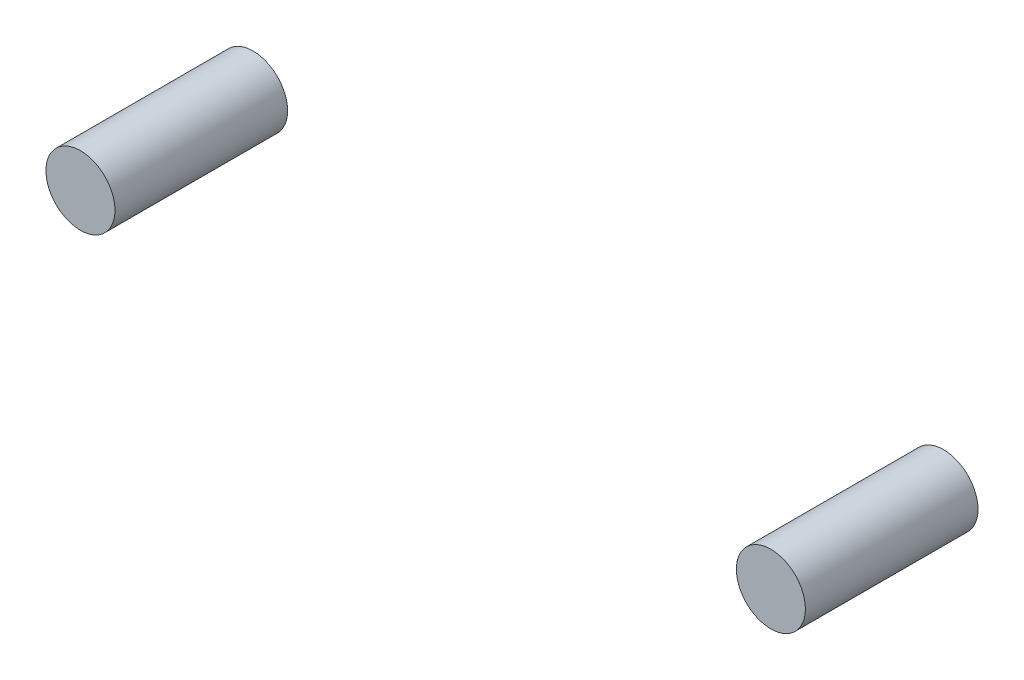
from build123d import *

# Parameters (mm, degrees)
SKETCH_1_R        = 1
EXTRUDE_1_DEPTH   = 5
EXTRUDE_1_2_DEPTH = 5


with BuildPart() as part:
    # 草图1 → 凸台-拉伸1 (new body)
    with BuildSketch(Plane.XY):
        with Locations((-8.861646235, 0)):
            Circle(SKETCH_1_R)
    extrude(amount=EXTRUDE_1_DEPTH)


with BuildPart() as body_2:
    # 草图1 → Extrude 1 2 (new body)
    with BuildSketch(Plane.XY):
        with Locations((11.138353765, 0)):
            Circle(SKETCH_1_R)
    extrude(amount=EXTRUDE_1_2_DEPTH)


solid = Compound([part.part, body_2.part])
